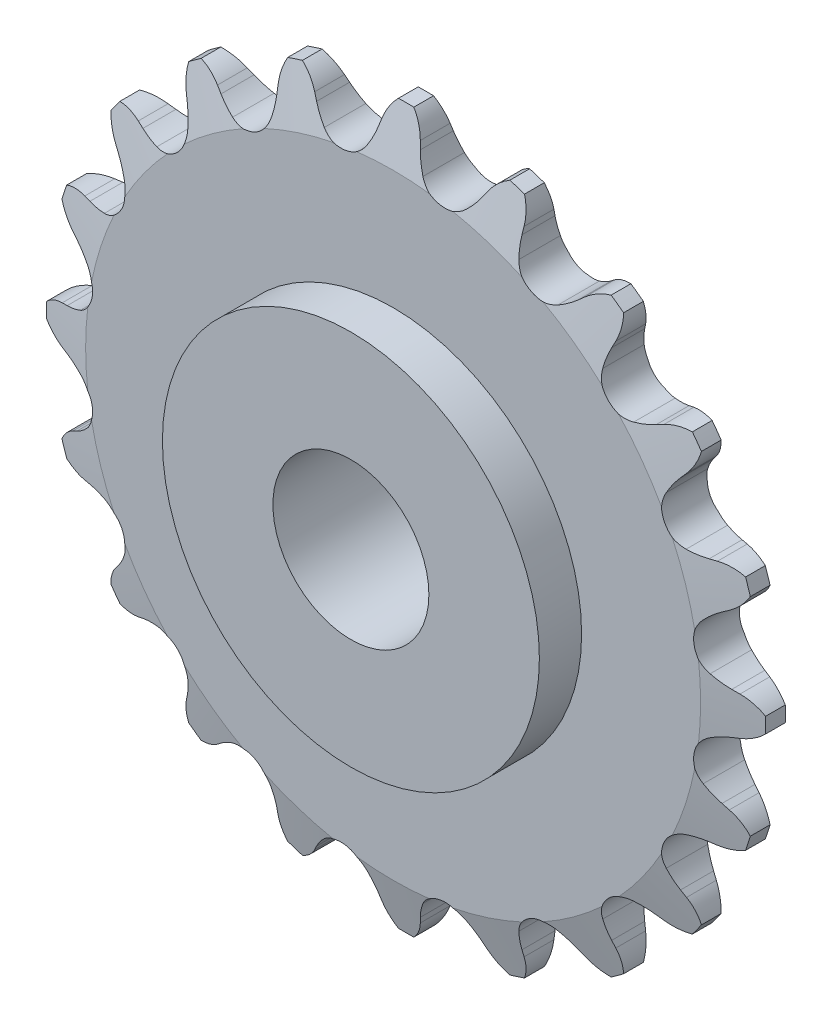
from build123d import *

# Parameters (mm, degrees)
CUT_EXTRUDE1_DEPTH      = 32.075047107
CIRPATTERN1_COUNT       = 20
SKETCH2_R               = 11.509375
BOSS_EXTRUDE1_DEPTH     = 3.9751
CUT_EXTRUDE2_DEPTH      = 32.297098467
CUT_EXTRUDE2_DEPTH_BACK = 32.297098467
SKETCH3_R               = 4.7625


with BuildPart() as part:
    # Sketch1 → Revolve1 (revolve)
    with BuildSketch(Plane(origin=(0, 0, 0), x_dir=(0, 0, -1), z_dir=(1, 0, 0)), mode=Mode.PRIVATE) as revolve1_sk:
        Polygon((-1.397, 0), (1.397, 0), (1.397, 18.776161059), (0.60325, 21.951161059), (-0.60325, 21.951161059), (-1.397, 18.776161059), align=None)
    revolve(revolve1_sk.sketch.rotate(Axis((0, 0, 1.397), (0, 0, -1)), 90), axis=Axis((0, 0, 1.397), (0, 0, -1)))

    # Sketch0 → Cut-Extrude1 (cut, symmetric)
    with BuildSketch(Plane.XY):
        with BuildLine():
            Line((5.277180446, -20.040203011), (5.061079282, -19.691667514))
            ThreePointArc((5.061079282, -19.691667514), (4.726289334, -19.224037863), (4.332593326, -18.804794197))
            ThreePointArc((4.332593326, -18.804794197), (2.909475179, -18.369703316), (1.690459867, -19.223267026))
            ThreePointArc((1.690459867, -19.223267026), (1.445586131, -19.743650204), (1.271687479, -20.291848214))
            Line((1.271687479, -20.291848214), (1.17386645, -20.690104102))
            ThreePointArc((1.17386645, -20.690104102), (0.140296792, -22.229219968), (-1.642266934, -22.738739792))
            ThreePointArc((-1.642266934, -22.738739792), (3.56638787, -22.517286816), (8.588545696, -21.118338259))
            ThreePointArc((8.588545696, -21.118338259), (6.735776564, -21.184598596), (5.277180446, -20.040203011))
        make_face()
    cut_extrude1 = extrude(amount=CUT_EXTRUDE1_DEPTH, both=True, mode=Mode.SUBTRACT)

    # CirPattern1: Cut-Extrude1 ×20 about axis
    cirpattern1_axis = Axis((0, 0, 0), (0, 0, 1))
    for i in range(1, CIRPATTERN1_COUNT):
        add(cut_extrude1.rotate(cirpattern1_axis, i * 360 / CIRPATTERN1_COUNT), mode=Mode.SUBTRACT)

    # Sketch2 → Boss-Extrude1 (add, symmetric)
    with BuildSketch(Plane.XY):
        Circle(SKETCH2_R)
    extrude(amount=BOSS_EXTRUDE1_DEPTH, both=True)

    # Sketch3 → Cut-Extrude2 (cut, two sides: drawn at the far end of the back side and taken through both)
    with BuildSketch(Plane.XY.offset(-CUT_EXTRUDE2_DEPTH_BACK)):
        Circle(SKETCH3_R)
    extrude(amount=CUT_EXTRUDE2_DEPTH + CUT_EXTRUDE2_DEPTH_BACK, mode=Mode.SUBTRACT)


solid = part.part
